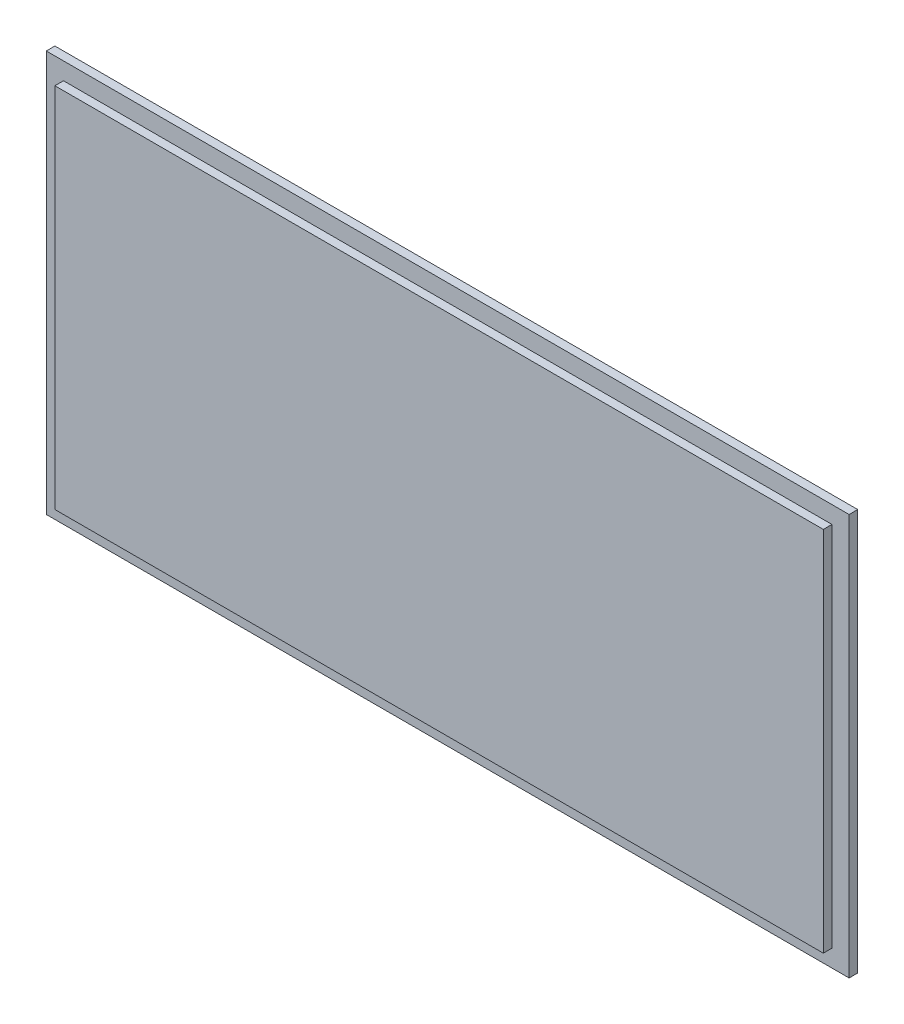
from build123d import *

# Parameters (mm, degrees)
SKETCH_1_W      = 140
SKETCH_1_H      = 70
EXTRUDE_1_DEPTH = 1.5
SKETCH_2_W      = 134
SKETCH_2_H      = 64
EXTRUDE_2_DEPTH = 1.5


with BuildPart() as part:
    # Эскиз1 → Бобышка-Вытянуть1 (new body)
    with BuildSketch(Plane.XY):
        with Locations((3.549880526, 0.365392274)):
            Rectangle(SKETCH_1_W, SKETCH_1_H)
    extrude(amount=EXTRUDE_1_DEPTH)

    # Эскиз2 → Бобышка-Вытянуть2 (add)
    with BuildSketch(Plane.XY.offset(1.5)):
        with Locations((3.549880526, 0.365392274)):
            Rectangle(SKETCH_2_W, SKETCH_2_H)
    extrude(amount=EXTRUDE_2_DEPTH)


solid = part.part
